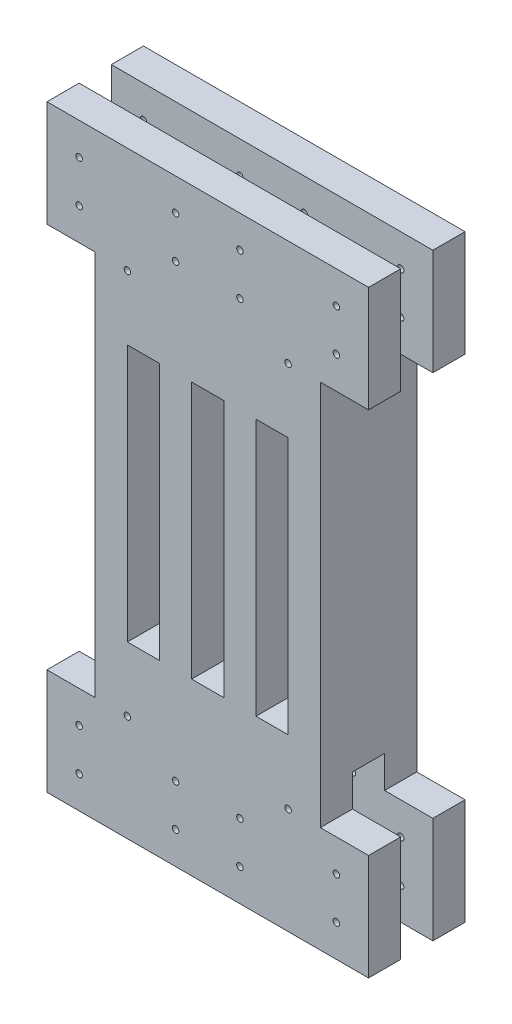
from build123d import *

# Parameters (mm, degrees)
BOSS_EXTRU_1_DEPTH      = 10
BOSS_EXTRU_1_DEPTH_BACK = 20
ESQUISSE1_R             = 1
ESQUISSE1_W             = 10
ESQUISSE1_H             = 80
ENL_V_START             = -10
ESQUISSE3_W             = 100
ESQUISSE3_H             = 43
ENL_V_MAT_EXTRU_1_DEPTH = 10


with BuildPart() as part:
    # Esquisse1 → Boss.-Extru.1 (new, two sides: drawn at the far end of the back side and taken through both)
    with BuildSketch(Plane.XY.offset(-20).offset(-BOSS_EXTRU_1_DEPTH_BACK)):
        Polygon((-36.141434162, 52.535821702), (-136.141434162, 52.535821702), (-136.141434162, 19.535821702), (-121.141434162, 19.535821702), (-121.141434162, -100.464178298), (-136.141434162, -100.464178298), (-136.141434162, -133.464178298), (-36.141434162, -133.464178298), (-36.141434162, -100.464178298), (-51.141434162, -100.464178298), (-51.141434162, 19.535821702), (-36.141434162, 19.535821702), align=None)
        with Locations((-111.141434162, -100.464178298)):
            Circle(ESQUISSE1_R, mode=Mode.SUBTRACT)
        with Locations((-61.141434162, -100.464178298)):
            Circle(ESQUISSE1_R, mode=Mode.SUBTRACT)
        with Locations((-61.141434162, 19.535821702)):
            Circle(ESQUISSE1_R, mode=Mode.SUBTRACT)
        with Locations((-111.141434162, 19.535821702)):
            Circle(ESQUISSE1_R, mode=Mode.SUBTRACT)
        with Locations((-126.141434162, 29.535821702)):
            Circle(ESQUISSE1_R, mode=Mode.SUBTRACT)
        with Locations((-126.141434162, 42.535821702)):
            Circle(ESQUISSE1_R, mode=Mode.SUBTRACT)
        with Locations((-96.141434162, 29.535821702)):
            Circle(ESQUISSE1_R, mode=Mode.SUBTRACT)
        with Locations((-96.141434162, 42.535821702)):
            Circle(ESQUISSE1_R, mode=Mode.SUBTRACT)
        with Locations((-76.141434162, 29.535821702)):
            Circle(ESQUISSE1_R, mode=Mode.SUBTRACT)
        with Locations((-76.141434162, 42.535821702)):
            Circle(ESQUISSE1_R, mode=Mode.SUBTRACT)
        with Locations((-46.141434162, 29.535821702)):
            Circle(ESQUISSE1_R, mode=Mode.SUBTRACT)
        with Locations((-46.141434162, 42.535821702)):
            Circle(ESQUISSE1_R, mode=Mode.SUBTRACT)
        with Locations((-66.141434162, -40.464178298)):
            Rectangle(ESQUISSE1_W, ESQUISSE1_H, mode=Mode.SUBTRACT)
        with Locations((-106.141434162, -40.464178298)):
            Rectangle(ESQUISSE1_W, ESQUISSE1_H, mode=Mode.SUBTRACT)
        with Locations((-86.141434162, -40.464178298)):
            Rectangle(ESQUISSE1_W, ESQUISSE1_H, mode=Mode.SUBTRACT)
        with Locations((-46.141434162, -110.464178298)):
            Circle(ESQUISSE1_R, mode=Mode.SUBTRACT)
        with Locations((-46.141434162, -123.464178298)):
            Circle(ESQUISSE1_R, mode=Mode.SUBTRACT)
        with Locations((-76.141434162, -110.464178298)):
            Circle(ESQUISSE1_R, mode=Mode.SUBTRACT)
        with Locations((-126.141434162, -123.464178298)):
            Circle(ESQUISSE1_R, mode=Mode.SUBTRACT)
        with Locations((-126.141434162, -110.464178298)):
            Circle(ESQUISSE1_R, mode=Mode.SUBTRACT)
        with Locations((-96.141434162, -123.464178298)):
            Circle(ESQUISSE1_R, mode=Mode.SUBTRACT)
        with Locations((-96.141434162, -110.464178298)):
            Circle(ESQUISSE1_R, mode=Mode.SUBTRACT)
        with Locations((-76.141434162, -123.464178298)):
            Circle(ESQUISSE1_R, mode=Mode.SUBTRACT)
    extrude(amount=BOSS_EXTRU_1_DEPTH + BOSS_EXTRU_1_DEPTH_BACK)

    # Esquisse3 → Enlèv. mat.-Extru.1 (cut)
    with BuildSketch(Plane(origin=(0, 0, -40), x_dir=(-1, 0, 0), z_dir=(0, 0, -1)).offset(ENL_V_START)):
        with Locations((86.141434162, -111.964178298)):
            Rectangle(ESQUISSE3_W, ESQUISSE3_H)
        with Locations((86.141434162, 31.035821702)):
            Rectangle(ESQUISSE3_W, ESQUISSE3_H)
    extrude(amount=-ENL_V_MAT_EXTRU_1_DEPTH, mode=Mode.SUBTRACT)


solid = part.part
